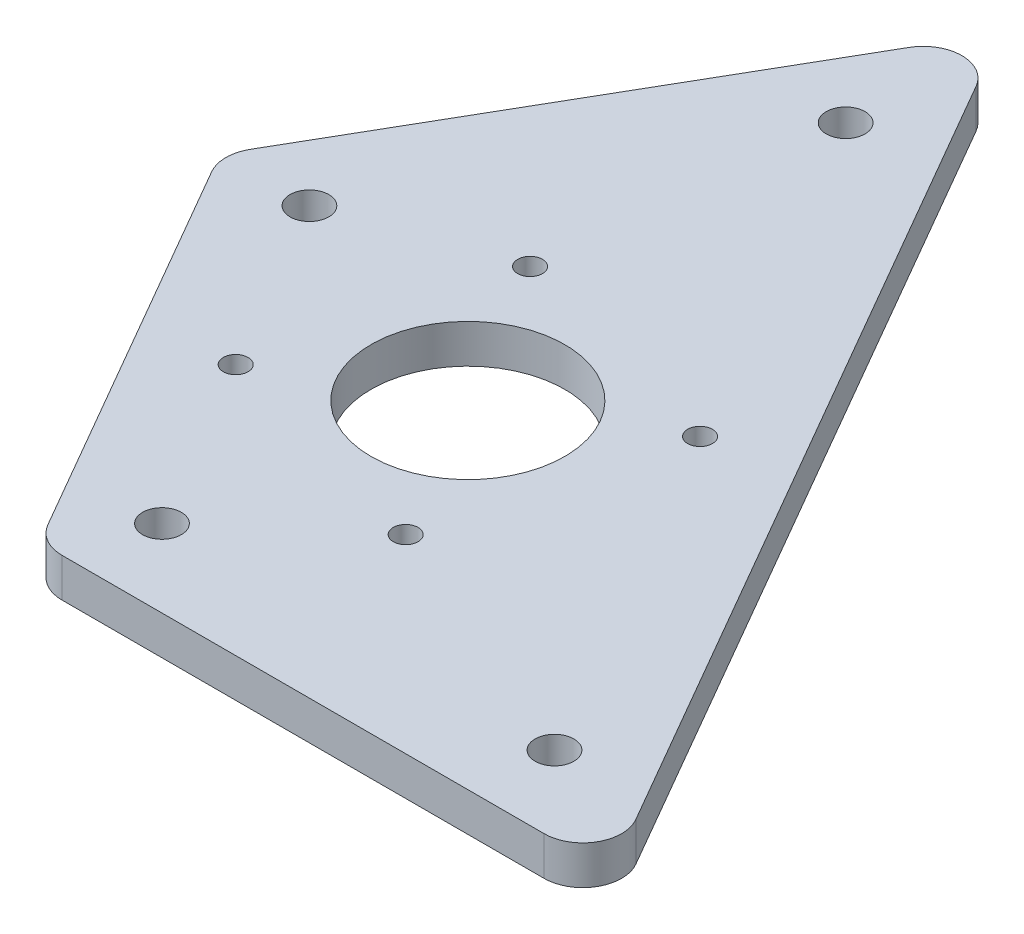
from build123d import *

# Parameters (mm, degrees)
CROQUIS1_R              = 2.5
CROQUIS1_R_2            = 1.6
CROQUIS1_R_3            = 12.5
SALIENTE_EXTRUIR1_DEPTH = 5
REDONDEO1_R             = 5


with BuildPart() as part:
    # Croquis1 → Saliente-Extruir1 (new body)
    with BuildSketch(Plane(origin=(0, 0, 0), x_dir=(1, 0, 0), z_dir=(0, 1, 0))):
        Polygon((51.292156122, 108.840620434), (119.90482032, -10), (46.188021535, -10), (14.43375673, 45), align=None)
        with Locations(Location((51.292156122, 88.840620434, 0), (0, 0, 270))):
            Circle(CROQUIS1_R, mode=Mode.SUBTRACT)
        with Locations(Location((102.584312245, 0, 0), (0, 0, 270))):
            Circle(CROQUIS1_R, mode=Mode.SUBTRACT)
        with Locations(Location((51.961524227, 0, 0), (0, 0, 270))):
            Circle(CROQUIS1_R, mode=Mode.SUBTRACT)
        with Locations(Location((25.980762114, 45, 0), (0, 0, 270))):
            Circle(CROQUIS1_R, mode=Mode.SUBTRACT)
        with Locations(Location((38.97114317, 22.5, 0), (0, 0, 270))):
            Circle(CROQUIS1_R_2, mode=Mode.SUBTRACT)
        with Locations(Location((46.994533568, 52.443700615, 0), (0, 0, 270))):
            Circle(CROQUIS1_R_2, mode=Mode.SUBTRACT)
        with Locations(Location((76.938234183, 44.420310217, 0), (0, 0, 270))):
            Circle(CROQUIS1_R_2, mode=Mode.SUBTRACT)
        with Locations(Location((68.914843785, 14.476609602, 0), (0, 0, 270))):
            Circle(CROQUIS1_R_2, mode=Mode.SUBTRACT)
        with Locations(Location((57.954688677, 33.460155108, 0), (0, 0, 270))):
            Circle(CROQUIS1_R_3, mode=Mode.SUBTRACT)
    extrude(amount=SALIENTE_EXTRUIR1_DEPTH)

    # Redondeo1
    redondeo1_edges = [part.edges().sort_by_distance(p)[0] for p in [
        (51.292156122, 2.5, -108.840620434),
        (119.90482032, 2.5, 10),
        (46.188021535, 2.5, 10),
        (14.43375673, 2.5, -45),
    ]]
    fillet(redondeo1_edges, radius=REDONDEO1_R)


solid = part.part
